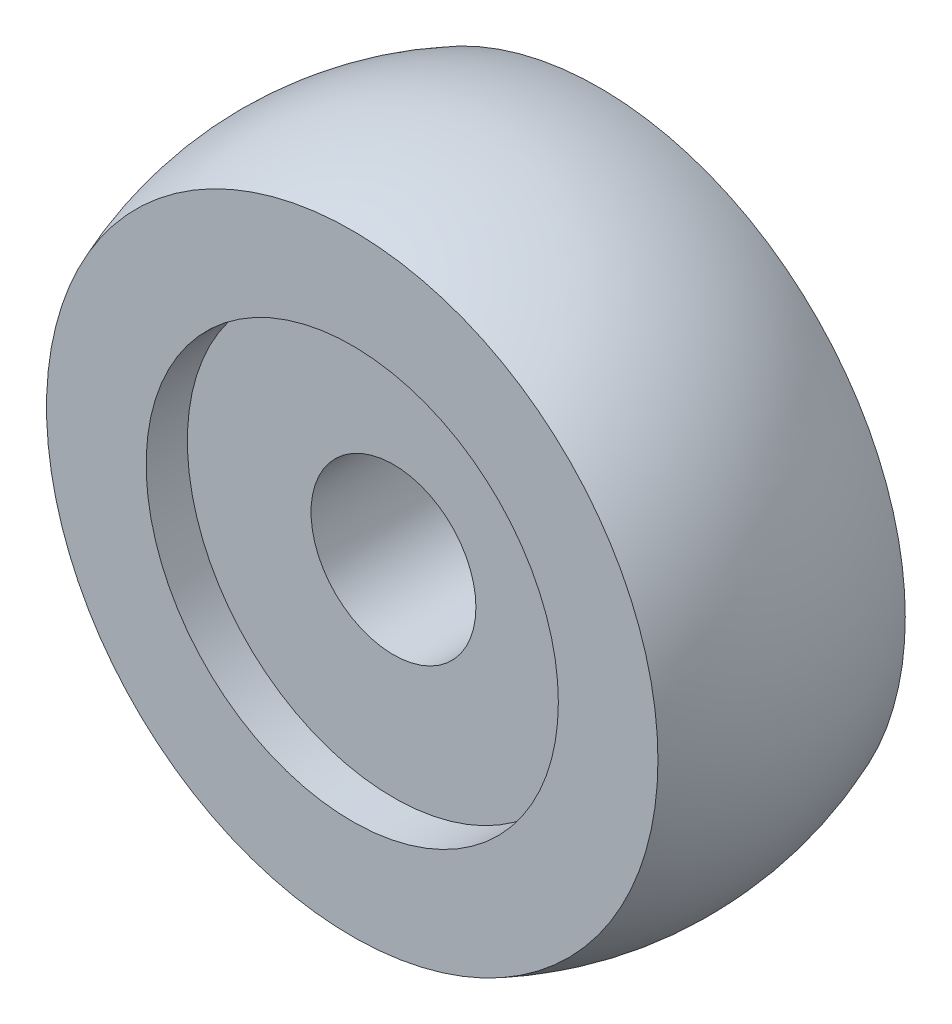
from build123d import *

# Parameters (mm, degrees)
CUT_EXTRUDE_START   = 3
SKETCH_2_R          = 9.058655207
CUT_EXTRUDE_1_DEPTH = 10
CUT_EXTRUDE_START_2 = -3
SKETCH_2_2_R        = 9.058655207
CUT_EXTRUDE_2_DEPTH = 10
SKETCH_3_R          = 5
CUT_EXTRUDE_3_DEPTH = 1
SKETCH_4_R          = 2
CUT_EXTRUDE_4_DEPTH = 5


with BuildPart() as part:
    # 草图1 → 旋转3 (revolve)
    with BuildSketch(Plane.XY):
        with BuildLine():
            Line((0, -8), (0, 8))
            ThreePointArc((0, 8), (-8, 0), (0, -8))
        make_face()
    revolve(axis=Axis((0, 8, 0), (0, -1, 0)))

    # 草图2 → 切除-拉伸1 (cut)
    with BuildSketch(Plane.XY.offset(CUT_EXTRUDE_START)):
        Circle(SKETCH_2_R)
    extrude(amount=CUT_EXTRUDE_1_DEPTH, mode=Mode.SUBTRACT)

    # 草图2<2> → 切除-拉伸2 (cut)
    with BuildSketch(Plane.XY.offset(CUT_EXTRUDE_START_2)):
        Circle(SKETCH_2_2_R)
    extrude(amount=-CUT_EXTRUDE_2_DEPTH, mode=Mode.SUBTRACT)

    # 草图3 → 切除-拉伸3 (cut)
    with BuildSketch(Plane.XY.offset(3)):
        Circle(SKETCH_3_R)
    cut_extrude_3 = extrude(amount=-CUT_EXTRUDE_3_DEPTH, mode=Mode.SUBTRACT)

    # 镜向1: 切除-拉伸3 across plane
    add(cut_extrude_3.mirror(Plane.XY), mode=Mode.SUBTRACT)

    # 草图4 → 切除-拉伸4 (cut)
    with BuildSketch(Plane.XY.offset(2)):
        Circle(SKETCH_4_R)
    extrude(amount=-CUT_EXTRUDE_4_DEPTH, mode=Mode.SUBTRACT)


solid = part.part
